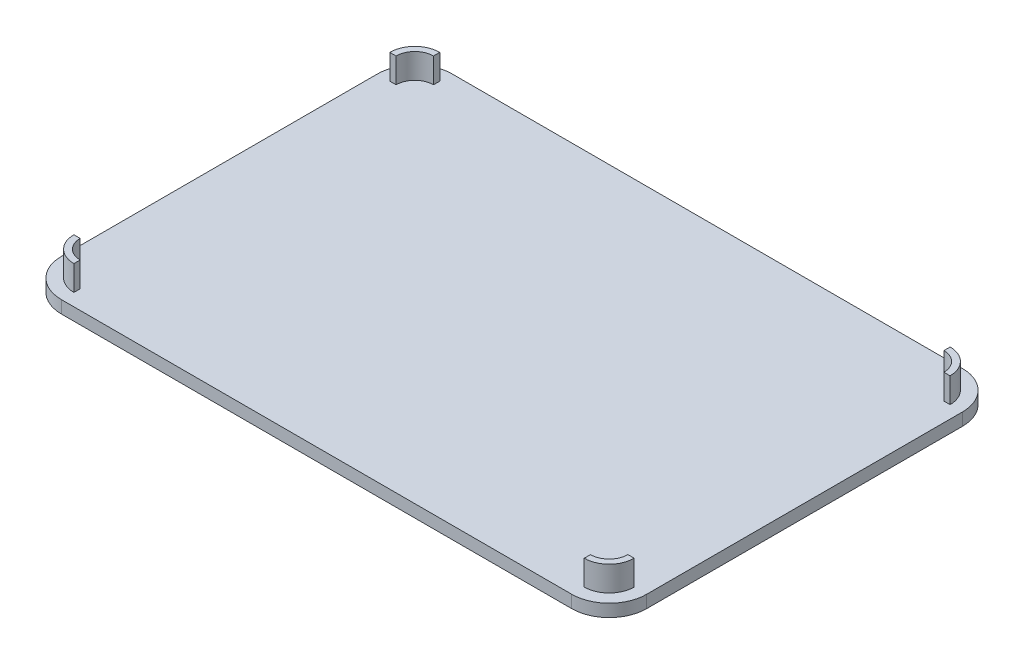
from build123d import *

# Parameters (mm, degrees)
SALIENTE_EXTRUIR1_DEPTH = 2
SALIENTE_EXTRUIR2_DEPTH = 4


with BuildPart() as part:
    # Croquis1 → Saliente-Extruir1 (new body)
    with BuildSketch(Plane(origin=(0, 0, 0), x_dir=(1, 0, 0), z_dir=(0, 1, 0))):
        with BuildLine():
            Line((-40.87, -31.3), (40.87, -31.3))
            ThreePointArc((40.87, -31.3), (45.112640687, -29.542640687), (46.87, -25.3))
            Line((46.87, -25.3), (46.87, 25.3))
            ThreePointArc((46.87, 25.3), (45.112640687, 29.542640687), (40.87, 31.3))
            Line((40.87, 31.3), (-40.87, 31.3))
            ThreePointArc((-40.87, 31.3), (-45.112640687, 29.542640687), (-46.87, 25.3))
            Line((-46.87, 25.3), (-46.87, -25.3))
            ThreePointArc((-46.87, -25.3), (-45.112640687, -29.542640687), (-40.87, -31.3))
        make_face()
    extrude(amount=SALIENTE_EXTRUIR1_DEPTH)

    # Croquis2 → Saliente-Extruir2 (add)
    with BuildSketch(Plane(origin=(0, 2, 0), x_dir=(1, 0, 0), z_dir=(0, 1, 0))):
        with BuildLine():
            ThreePointArc((43.87, 25.3), (42.991320344, 27.421320344), (40.87, 28.3))
            Line((40.87, 28.3), (40.87, 29.3))
            ThreePointArc((40.87, 29.3), (43.698427125, 28.128427125), (44.87, 25.3))
            Line((44.87, 25.3), (43.87, 25.3))
        make_face()
        with BuildLine():
            Line((-44.87, 25.3), (-44.37, 25.3))
            ThreePointArc((-44.37, 25.3), (-43.344873734, 27.774873734), (-40.87, 28.8))
            Line((-40.87, 28.8), (-40.87, 29.3))
            ThreePointArc((-40.87, 29.3), (-43.698427125, 28.128427125), (-44.87, 25.3))
        make_face()
        with BuildLine():
            Line((-44.37, 25.3), (-43.87, 25.3))
            ThreePointArc((-43.87, 25.3), (-42.991320344, 27.421320344), (-40.87, 28.3))
            Line((-40.87, 28.3), (-40.87, 28.8))
            ThreePointArc((-40.87, 28.8), (-43.344873734, 27.774873734), (-44.37, 25.3))
        make_face()
        with BuildLine():
            ThreePointArc((-44.87, -25.3), (-43.698427125, -28.128427125), (-40.87, -29.3))
            Line((-40.87, -29.3), (-40.87, -28.3))
            ThreePointArc((-40.87, -28.3), (-42.991320344, -27.421320344), (-43.87, -25.3))
            Line((-43.87, -25.3), (-44.87, -25.3))
        make_face()
        with BuildLine():
            ThreePointArc((43.87, -25.3), (42.991320344, -27.421320344), (40.87, -28.3))
            Line((40.87, -28.3), (40.87, -29.3))
            ThreePointArc((40.87, -29.3), (43.698427125, -28.128427125), (44.87, -25.3))
            Line((44.87, -25.3), (43.87, -25.3))
        make_face()
    extrude(amount=SALIENTE_EXTRUIR2_DEPTH)


solid = part.part
